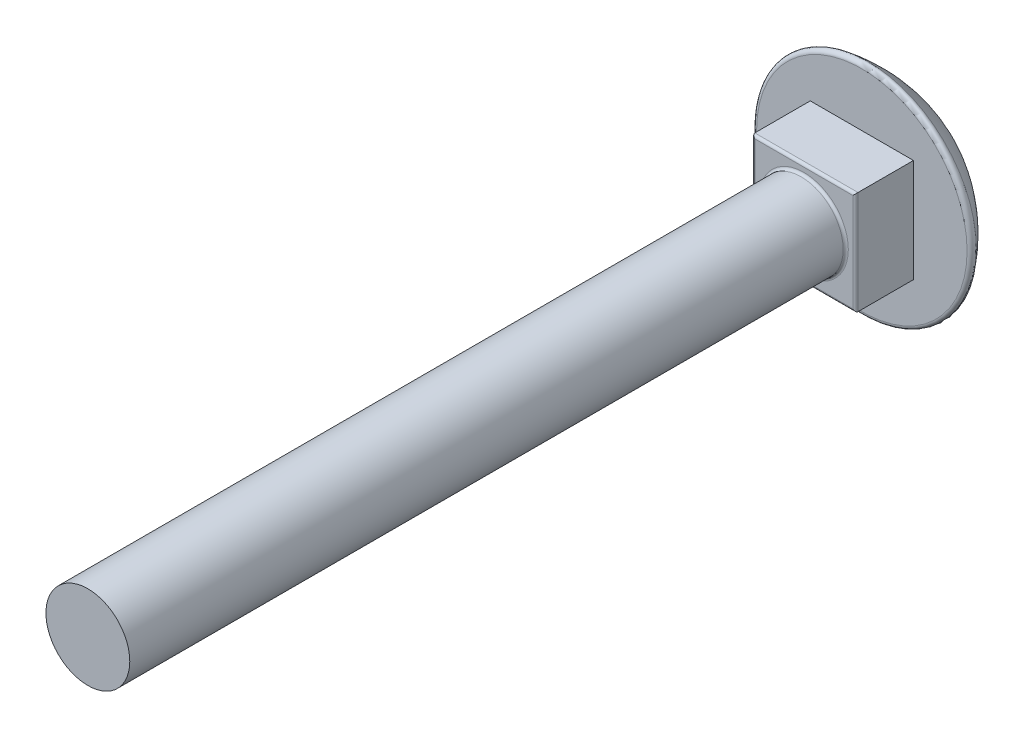
from build123d import *

# Parameters (mm, degrees)
SKETCH2_W           = 8
SKETCH2_H           = 8
BOSS_EXTRUDE1_DEPTH = 4.5
FILLET3_R           = 0.2
FILLET4_R           = 0.3


with BuildPart() as part:
    # Sketch1 → Revolve1 (revolve)
    with BuildSketch(Plane(origin=(0, 0, 0), x_dir=(1, 0, 0), z_dir=(0, 1, 0))):
        with BuildLine():
            Line((0, 0), (0, 60))
            Line((0, 60), (5.5, 60))
            ThreePointArc((5.5, 60), (1.687101474, 63.483677579), (-3.25, 65))
            Line((-3.25, 65), (-3.25, 60))
            Line((-3.25, 60), (-3.25, 0))
            Line((-3.25, 0), (0, 0))
        make_face()
    revolve(axis=Axis((-3.25, 0, 0), (0, 0, -1)))

    # Sketch2 → Boss-Extrude1 (add)
    with BuildSketch(Plane.XY.offset(-60)):
        with Locations((-3.25, 0)):
            Rectangle(SKETCH2_W, SKETCH2_H)
    extrude(amount=BOSS_EXTRUDE1_DEPTH)

    # Fillet3
    fillet3_edges = [part.edges().sort_by_distance(p)[0] for p in [
        (-6.5, 0, -55.5),
        (0.75, 0, -55.5),
        (-3.25, 4, -55.5),
        (-7.25, 0, -55.5),
        (-3.25, -4, -55.5),
    ]]
    fillet(fillet3_edges, radius=FILLET3_R)

    # Fillet4
    fillet4_edges = [part.edges().sort_by_distance(p)[0] for p in [
        (-12, 0, -60),
    ]]
    fillet(fillet4_edges, radius=FILLET4_R)


solid = part.part
